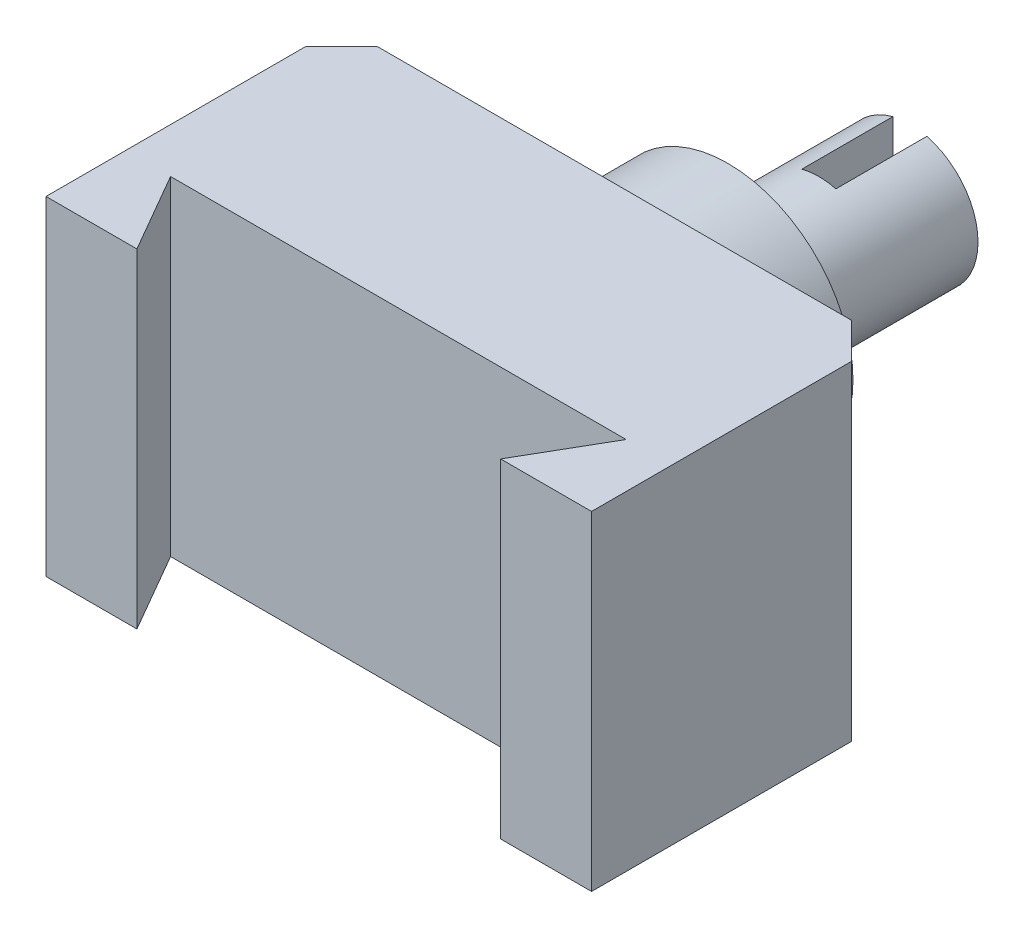
from build123d import *

# Parameters (mm, degrees)
BOSS_EXTRUDE1_DEPTH = 45.974
SKETCH2_R           = 34.925
BOSS_EXTRUDE2_DEPTH = 31.75
SKETCH3_R           = 19.05
BOSS_EXTRUDE3_DEPTH = 50.8
CUT_EXTRUDE1_START  = -25.4
CUT_EXTRUDE1_DEPTH  = 25.4
CHAMFER1_SIZE       = 10


with BuildPart() as part:
    # Sketch1 → Boss-Extrude1 (new, symmetric)
    with BuildSketch(Plane(origin=(0, 0, 0), x_dir=(1, 0, 0), z_dir=(0, 1, 0))):
        Polygon((-50.8, -41.275), (-63.631609733, -19.05), (63.631609733, -19.05), (50.8, -41.275), (76.2, -41.275), (76.2, 41.275), (-76.2, 41.275), (-76.2, -41.275), align=None)
    extrude(amount=BOSS_EXTRUDE1_DEPTH, both=True)

    # Sketch2 → Boss-Extrude2 (add)
    with BuildSketch(Plane(origin=(0, 0, -41.275), x_dir=(-1, 0, 0), z_dir=(0, 0, -1))):
        Circle(SKETCH2_R)
    extrude(amount=BOSS_EXTRUDE2_DEPTH)

    # Sketch3 → Boss-Extrude3 (add)
    with BuildSketch(Plane(origin=(0, 0, -73.025), x_dir=(-1, 0, 0), z_dir=(0, 0, -1))):
        Circle(SKETCH3_R)
    extrude(amount=BOSS_EXTRUDE3_DEPTH)

    # Sketch4 → Cut-Extrude1 (cut)
    with BuildSketch(Plane(origin=(0, 0, -123.825), x_dir=(-1, 0, 0), z_dir=(0, 0, -1)).offset(CUT_EXTRUDE1_START)):
        with BuildLine():
            Line((-4.7625, 18.445083186), (-4.7625, -18.445083186))
            ThreePointArc((-4.7625, -18.445083186), (0, -19.05), (4.7625, -18.445083186))
            Line((4.7625, -18.445083186), (4.7625, 18.445083186))
            ThreePointArc((4.7625, 18.445083186), (0, 19.05), (-4.7625, 18.445083186))
        make_face()
    extrude(amount=CUT_EXTRUDE1_DEPTH, mode=Mode.SUBTRACT)

    # Chamfer1
    chamfer1_edges = [part.edges().sort_by_distance(p)[0] for p in [
        (-76.2, 0, -41.275),
        (76.2, 0, -41.275),
    ]]
    chamfer(chamfer1_edges, length=CHAMFER1_SIZE)


solid = part.part
